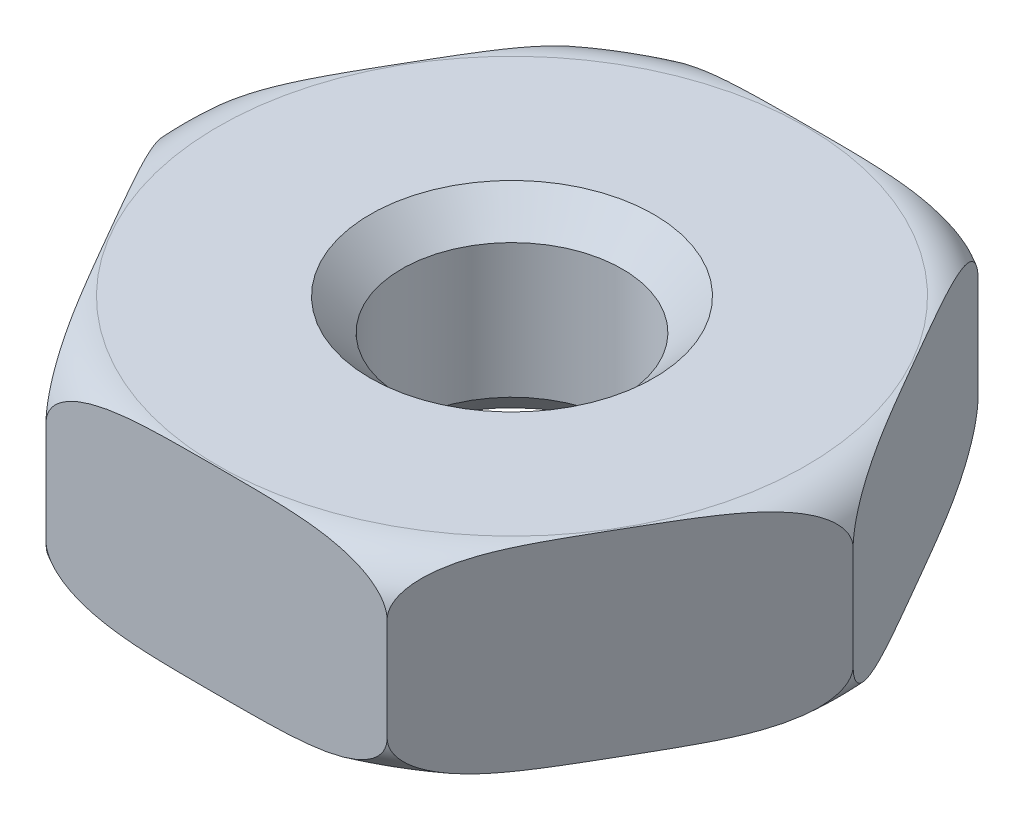
from build123d import *

# Parameters (mm, degrees)
BOSS_EXTRUDE1_DEPTH   = 1.5875
F_2_56_TAPPED_HOLE1_D = 1.778
CHAMFER2_SIZE         = 0.254


with BuildPart() as part:
    # Sketch1 → Boss-Extrude1 (new body)
    with BuildSketch(Plane(origin=(0, 0, 0), x_dir=(1, 0, 0), z_dir=(0, 1, 0))):
        Polygon((1.374815329, 2.38125), (-1.374815329, 2.38125), (-2.749630657, 0), (-1.374815329, -2.38125), (1.374815329, -2.38125), (2.749630657, 0), align=None)
    extrude(amount=BOSS_EXTRUDE1_DEPTH)

    # #2-56 Tapped Hole1 (through all)
    with Locations(Plane(origin=(0, 1.5875, 0), x_dir=(1, 0, 0), z_dir=(0, 1, 0))):
        with Locations((0, 0)):
            Hole(F_2_56_TAPPED_HOLE1_D / 2)

    # Sketch5 → Cut-Revolve2 (revolve, cut)
    with BuildSketch(Plane.XY, mode=Mode.PRIVATE) as cut_revolve2_sk:
        with BuildLine():
            Line((0, 0), (2.368630657, 0))
            ThreePointArc((2.368630657, 0), (2.638038341, 0.111592316), (2.749630657, 0.381))
            Line((2.749630657, 0.381), (2.749630657, 1.2065))
            ThreePointArc((2.749630657, 1.2065), (2.638038341, 1.475907684), (2.368630657, 1.5875))
            Line((2.368630657, 1.5875), (0, 1.5875))
            Line((0, 1.5875), (0, 2.0955))
            Line((0, 2.0955), (5.08, 2.0955))
            Line((5.08, 2.0955), (5.08, -0.4445))
            Line((5.08, -0.4445), (0, -0.4445))
            Line((0, -0.4445), (0, 0))
        make_face()
    revolve(cut_revolve2_sk.sketch.rotate(Axis((0, 0, 0), (0, 1, 0)), 90), axis=Axis((0, 0, 0), (0, 1, 0)), mode=Mode.SUBTRACT)

    # Chamfer2
    chamfer2_edges = [part.edges().sort_by_distance(p)[0] for p in [
        (0.889, 1.5875, 0),
        (0.889, 0, 0),
    ]]
    chamfer(chamfer2_edges, length=CHAMFER2_SIZE)


solid = part.part
